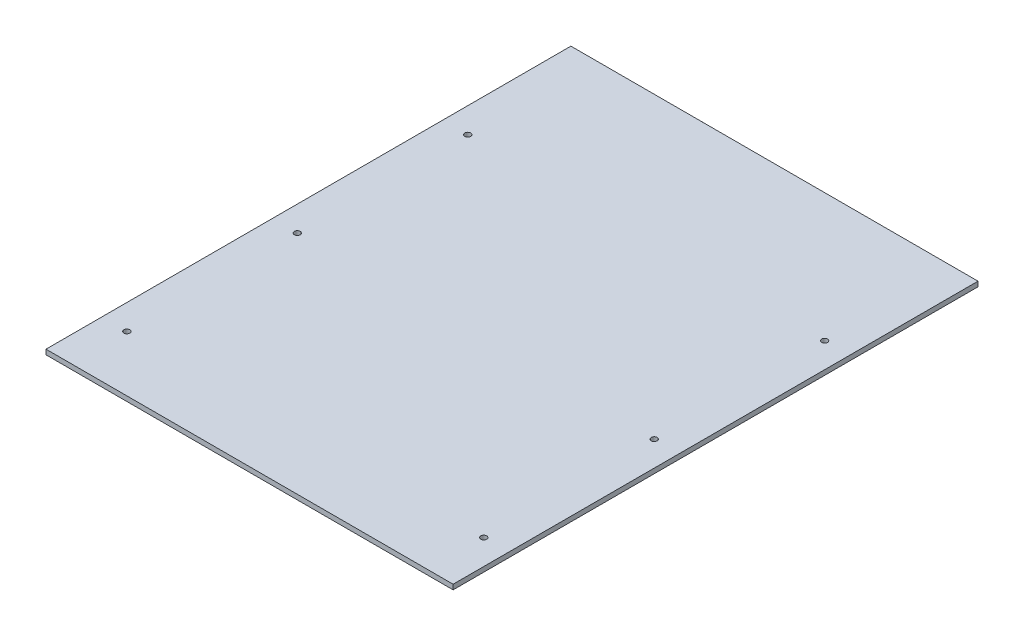
from build123d import *

# Parameters (mm, degrees)
SKETCH1_W           = 463.55
SKETCH1_H           = 597.662
SKETCH1_R           = 3.3782
BOSS_EXTRUDE1_DEPTH = 5.588


with BuildPart() as part:
    # Sketch1 → Boss-Extrude1 (new body)
    with BuildSketch(Plane(origin=(0, 0, 0), x_dir=(1, 0, 0), z_dir=(0, 1, 0))):
        with Locations((231.775, 298.831)):
            Rectangle(SKETCH1_W, SKETCH1_H)
        with Locations(Location((28.575, 63.5, 0), (0, 0, 270))):
            Circle(SKETCH1_R, mode=Mode.SUBTRACT)
        with Locations(Location((28.575, 257.556, 0), (0, 0, 270))):
            Circle(SKETCH1_R, mode=Mode.SUBTRACT)
        with Locations(Location((28.575, 451.612, 0), (0, 0, 270))):
            Circle(SKETCH1_R, mode=Mode.SUBTRACT)
        with Locations(Location((434.975, 451.612, 0), (0, 0, 90))):
            Circle(SKETCH1_R, mode=Mode.SUBTRACT)
        with Locations(Location((434.975, 257.556, 0), (0, 0, 90))):
            Circle(SKETCH1_R, mode=Mode.SUBTRACT)
        with Locations(Location((434.975, 63.5, 0), (0, 0, 90))):
            Circle(SKETCH1_R, mode=Mode.SUBTRACT)
    extrude(amount=BOSS_EXTRUDE1_DEPTH)


solid = part.part
